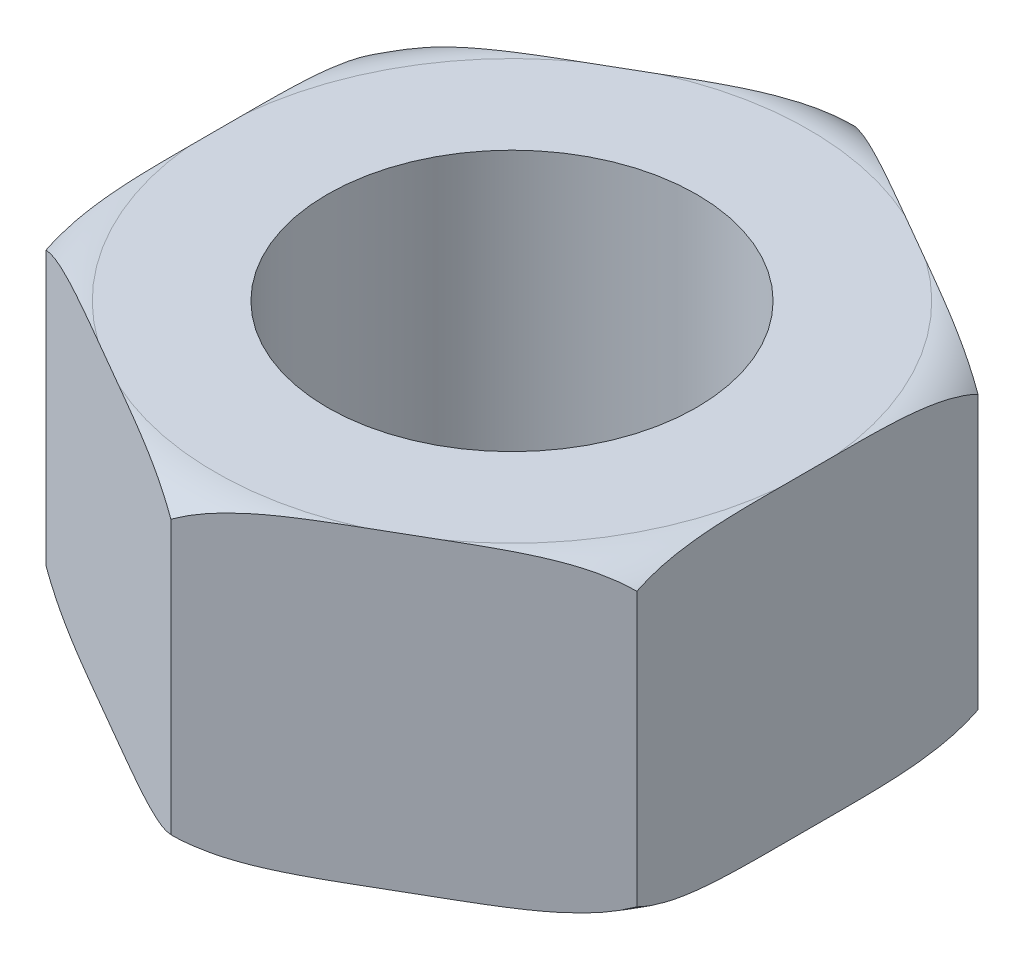
from build123d import *

# Parameters (mm, degrees)
SKIZZE1_R                       = 5
AUFSATZ_LINEAR_AUSTRAGEN1_DEPTH = 8.4


with BuildPart() as part:
    # Skizze1 → Aufsatz-Linear austragen1 (new body)
    with BuildSketch(Plane(origin=(0, 0, 0), x_dir=(1, 0, 0), z_dir=(0, 1, 0))):
        Polygon((0, 9.237604307), (-8, 4.618802154), (-8, -4.618802154), (0, -9.237604307), (8, -4.618802154), (8, 4.618802154), align=None)
        with Locations(Location((0, 0, 0), (0, 0, 270))):
            Circle(SKIZZE1_R, mode=Mode.SUBTRACT)
    extrude(amount=AUFSATZ_LINEAR_AUSTRAGEN1_DEPTH)

    # Skizze2 → Schnitt-Rotation1 (revolve, cut)
    with BuildSketch(Plane(origin=(0, 0, 0), x_dir=(0, 0, -1), z_dir=(1, 0, 0))):
        with BuildLine():
            Line((8.037604307, 8.4), (9.237604307, 8.4))
            Line((9.237604307, 8.4), (9.237604307, 7.9))
            ThreePointArc((9.237604307, 7.9), (8.687604307, 8.27), (8.037604307, 8.4))
        make_face()
        with BuildLine():
            Line((8.037604307, 0), (9.237604307, 0))
            Line((9.237604307, 0), (9.237604307, 0.5))
            ThreePointArc((9.237604307, 0.5), (8.687604307, 0.13), (8.037604307, 0))
        make_face()
    revolve(axis=Axis((0, 0, 0), (0, -1, 0)), mode=Mode.SUBTRACT)


solid = part.part
